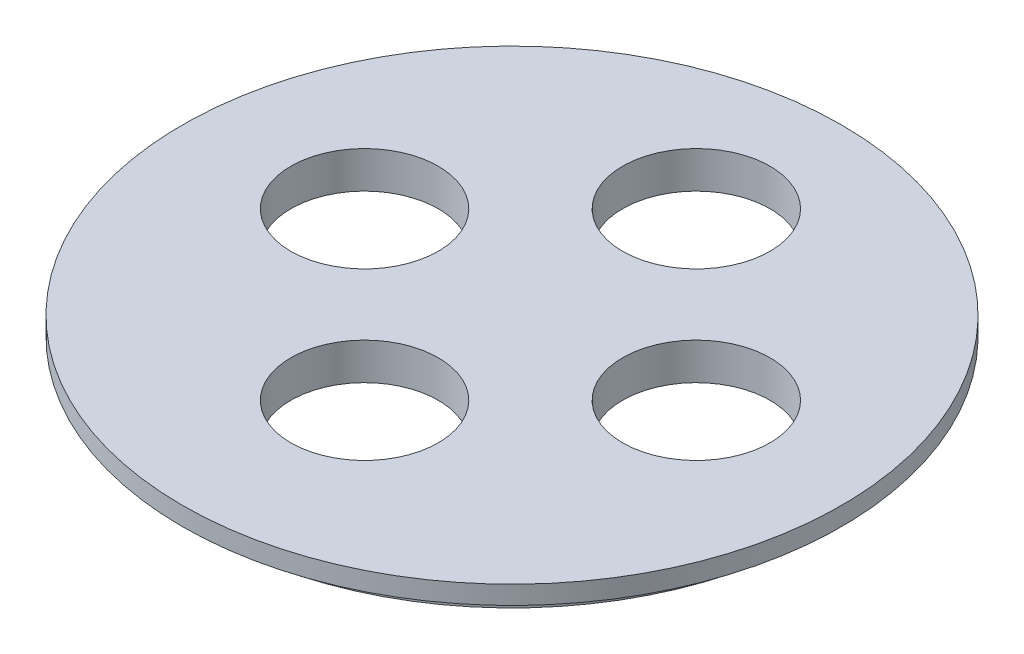
from build123d import *

# Parameters (mm, degrees)
SKETCH1_R           = 56.769
BOSS_EXTRUDE1_DEPTH = 3.175
SKETCH1_3_R         = 52.80025
BOSS_EXTRUDE2_DEPTH = 3.175
SKETCH2_R           = 12.7
CUT_EXTRUDE1_DEPTH  = 81.534223918


with BuildPart() as part:
    # Sketch1 → Boss-Extrude1 (new body)
    with BuildSketch(Plane(origin=(0, 0, 0), x_dir=(1, 0, 0), z_dir=(0, 1, 0))):
        Circle(SKETCH1_R)
    extrude(amount=BOSS_EXTRUDE1_DEPTH)

    # Sketch1<3> → Boss-Extrude2 (add)
    with BuildSketch(Plane(origin=(0, 0, 0), x_dir=(1, 0, 0), z_dir=(0, 1, 0))):
        Circle(SKETCH1_3_R)
    extrude(amount=-BOSS_EXTRUDE2_DEPTH)

    # Sketch2 → Cut-Extrude1 (cut, through all)
    with BuildSketch(Plane(origin=(0, 3.175, 0), x_dir=(1, 0, 0), z_dir=(0, 1, 0))):
        with Locations((0, 31.75)):
            Circle(SKETCH2_R)
        with Locations((28.575, 3.175)):
            Circle(SKETCH2_R)
        with Locations((0, -25.4)):
            Circle(SKETCH2_R)
        with Locations((-28.575, 3.175)):
            Circle(SKETCH2_R)
    extrude(amount=-CUT_EXTRUDE1_DEPTH, mode=Mode.SUBTRACT)


solid = part.part
